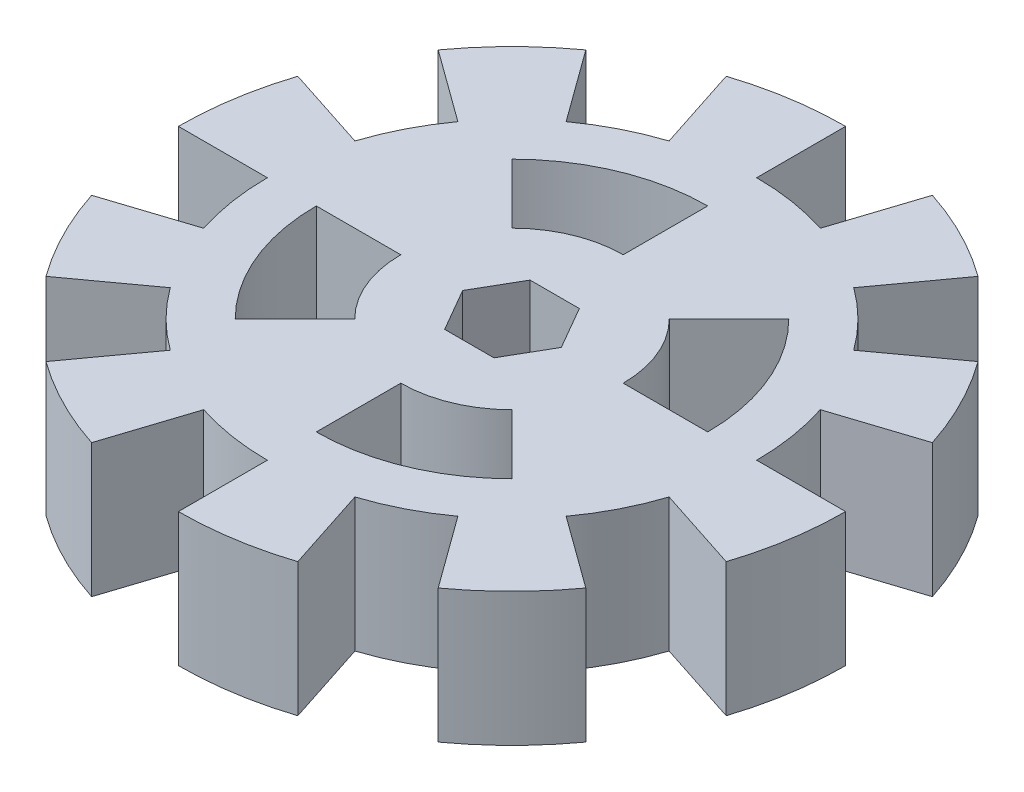
from build123d import *

# Parameters (mm, degrees)
SKETCH1_R           = 47.625
BOSS_EXTRUDE1_DEPTH = 19.05
CUT_EXTRUDE1_DEPTH  = 70.9941694
CIRPATTERN1_COUNT   = 10
CUT_EXTRUDE2_DEPTH  = 15.24
SKETCH5_R           = 4.064
CUT_EXTRUDE3_DEPTH  = 70.054607739
CUT_EXTRUDE4_DEPTH  = 70.9941694


with BuildPart() as part:
    # Sketch1 → Boss-Extrude1 (new body)
    with BuildSketch(Plane(origin=(0, 0, 0), x_dir=(1, 0, 0), z_dir=(0, 1, 0))):
        with Locations(Location((0, 0, 0), (0, 0, 90))):
            Circle(SKETCH1_R)
    extrude(amount=BOSS_EXTRUDE1_DEPTH)

    # Sketch3 → Cut-Extrude1 (cut, symmetric)
    with BuildSketch(Plane(origin=(0, 19.05, 0), x_dir=(1, 0, 0), z_dir=(0, 1, 0))):
        with BuildLine():
            Line((0, 47.625), (0, 34.925))
            ThreePointArc((0, 34.925), (5.463473692, 34.495015295), (10.792418529, 33.215648832))
            Line((10.792418529, 33.215648832), (14.716934357, 45.294066589))
            ThreePointArc((14.716934357, 45.294066589), (7.450191398, 47.038657221), (0, 47.625))
        make_face()
    cut_extrude1 = extrude(amount=CUT_EXTRUDE1_DEPTH, both=True, mode=Mode.SUBTRACT)

    # CirPattern1: Cut-Extrude1 ×10 about axis
    cirpattern1_axis = Axis((0, 0, 0), (0, 1, 0))
    for i in range(1, CIRPATTERN1_COUNT):
        add(cut_extrude1.rotate(cirpattern1_axis, i * 360 / CIRPATTERN1_COUNT), mode=Mode.SUBTRACT)

    # Sketch4 → Cut-Extrude2 (cut)
    with BuildSketch(Plane(origin=(0, 19.05, 0), x_dir=(1, 0, 0), z_dir=(0, 1, 0))):
        Polygon((-3.519527241, 6.096), (3.519527241, 6.096), (7.039054482, 0), (3.519527241, -6.096), (-3.519527241, -6.096), (-7.039054482, 0), align=None)
    extrude(amount=-CUT_EXTRUDE2_DEPTH, mode=Mode.SUBTRACT)

    # Sketch5 → Cut-Extrude3 (cut, through all)
    with BuildSketch(Plane(origin=(0, 3.81, 0), x_dir=(1, 0, 0), z_dir=(0, 1, 0))):
        with Locations(Location((0, 0, 0), (0, 0, 270))):
            Circle(SKETCH5_R)
    extrude(amount=-CUT_EXTRUDE3_DEPTH, mode=Mode.SUBTRACT)

    # Sketch6 → Cut-Extrude4 (cut, through all)
    with BuildSketch(Plane(origin=(0, 19.05, 0), x_dir=(1, 0, 0), z_dir=(0, 1, 0))):
        with BuildLine():
            ThreePointArc((-11.225320151, 11.225320151), (-6.075099489, 14.666587579), (0, 15.875))
            Line((0, 15.875), (0, 27.94))
            ThreePointArc((0, 27.94), (-10.6921751, 25.813194138), (-19.756563466, 19.756563466))
            Line((-19.756563466, 19.756563466), (-11.225320151, 11.225320151))
        make_face()
        with BuildLine():
            Line((19.756563466, 19.756563466), (11.225320151, 11.225320151))
            ThreePointArc((11.225320151, 11.225320151), (14.666587579, 6.075099489), (15.875, 0))
            Line((15.875, 0), (27.94, 0))
            ThreePointArc((27.94, 0), (25.813194138, 10.6921751), (19.756563466, 19.756563466))
        make_face()
        with BuildLine():
            Line((19.756563466, -19.756563466), (11.225320151, -11.225320151))
            ThreePointArc((11.225320151, -11.225320151), (6.075099489, -14.666587579), (0, -15.875))
            Line((0, -15.875), (0, -27.94))
            ThreePointArc((0, -27.94), (10.6921751, -25.813194138), (19.756563466, -19.756563466))
        make_face()
        with BuildLine():
            Line((-19.756563466, -19.756563466), (-11.225320151, -11.225320151))
            ThreePointArc((-11.225320151, -11.225320151), (-14.666587579, -6.075099489), (-15.875, 0))
            Line((-15.875, 0), (-27.94, 0))
            ThreePointArc((-27.94, 0), (-25.813194138, -10.6921751), (-19.756563466, -19.756563466))
        make_face()
    extrude(amount=-CUT_EXTRUDE4_DEPTH, mode=Mode.SUBTRACT)


solid = part.part
